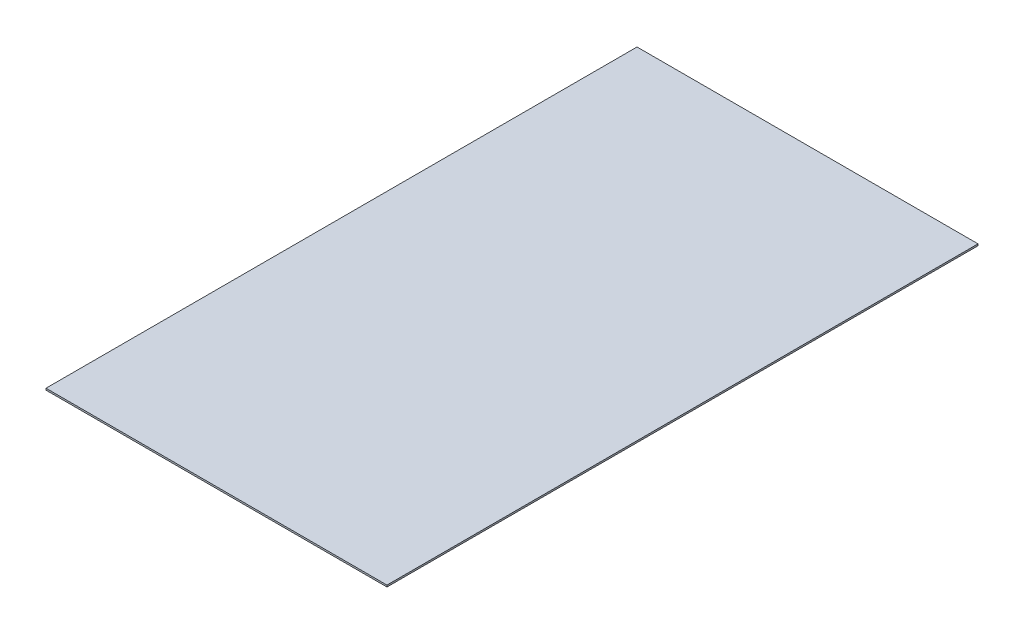
from build123d import *

# Parameters (mm, degrees)
SKETCH1_W           = 300
SKETCH1_H           = 520
BOSS_EXTRUDE1_DEPTH = 1.5


with BuildPart() as part:
    # Sketch1 → Boss-Extrude1 (new body)
    with BuildSketch(Plane(origin=(0, 0, 0), x_dir=(1, 0, 0), z_dir=(0, 1, 0))):
        with Locations((0, 260)):
            Rectangle(SKETCH1_W, SKETCH1_H)
    extrude(amount=BOSS_EXTRUDE1_DEPTH)


solid = part.part
